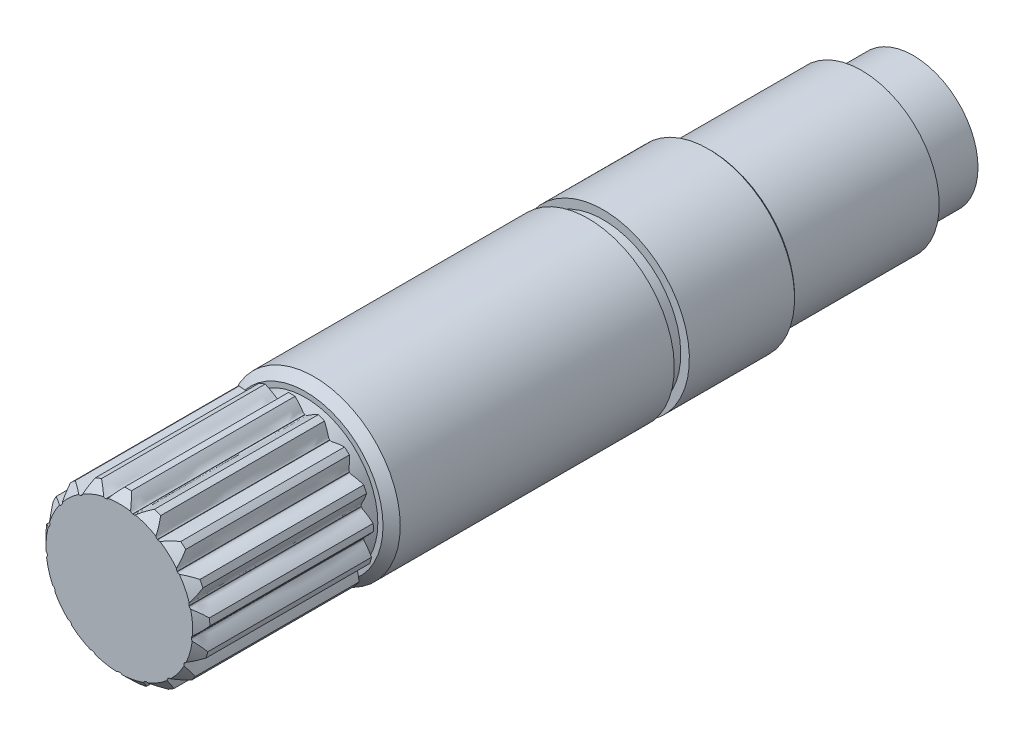
from build123d import *
from OCP.BRepFilletAPI import BRepFilletAPI_MakeChamfer

# Parameters (mm, degrees)
SKETCH12_R              = 10
SHAFT_DEPTH             = 21.5
SKETCH13_R              = 8.398146
MOTOR_SIDE_RELIEF_DEPTH = 1.587
MOTOR_SPLINE_DEPTH      = 20
CHAMFER3_SIZE           = 1
SKETCH23_W              = 1
SKETCH23_H              = 1.75
CHAMFER4_SIZE           = 1
CHAMFER4_SIZE2          = 0.466307658
CHAMFER5_SIZE           = 0.25
CHAMFER6_SIZE           = 1


with BuildPart() as part:
    # Sketch12 → Shaft (new, symmetric)
    with BuildSketch(Plane.XY):
        Circle(SKETCH12_R)
    extrude(amount=SHAFT_DEPTH, both=True)

    # Sketch13 → Motor side relief (add)
    with BuildSketch(Plane.XY.offset(21.5)):
        Circle(SKETCH13_R)
    extrude(amount=MOTOR_SIDE_RELIEF_DEPTH)

    # Sketch15 → Motor spline (add)
    with BuildSketch(Plane.XY.offset(23.087)):
        with BuildLine():
            Line((4.440221189, 7.12834427), (4.421054163, 7.140247638))
            Line((4.421054163, 7.140247638), (4.401855226, 7.152099468))
            add(Edge.make_bspline(
                [(4.401855226, 7.152099468), (4.346074893, 7.18643022), (4.303271658, 7.233316124), (4.247234181, 7.342487901), (4.237804809, 7.408052721), (4.194006084, 7.602023317), (4.124459498, 7.868486133), (3.983153486, 8.288727427), (3.862105942, 8.580360972), (3.794372065, 8.728433243)],
                knots=[0, 0, 0, 0, 0.125, 0.125, 0.25, 0.25, 0.5, 0.75, 1, 1, 1, 1], degree=3, weights=[1, 1, 1, 1, 1, 1, 1, 1, 1, 1]))
            ThreePointArc((3.794372065, 8.728433243), (3.438117558, 8.874804443), (3.076232661, 9.006641931))
            add(Edge.make_bspline(
                [(3.076232661, 9.006641931), (2.926421077, 8.942847219), (2.64049232, 8.808876568), (2.252952462, 8.593511743), (2.022042097, 8.443446649), (1.858997303, 8.329607659), (1.80785818, 8.287507199), (1.692897433, 8.244580486), (1.629678632, 8.238767738), (1.56532799, 8.250975974)],
                knots=[0, 0, 0, 0, 0.25, 0.5, 0.75, 0.75, 0.875, 0.875, 1, 1, 1, 1], degree=3, weights=[1, 1, 1, 1, 1, 1, 1, 1, 1, 1]))
            Line((1.56532799, 8.250975974), (1.543155278, 8.255151605))
            Line((1.543155278, 8.255151605), (1.520971428, 8.259267652))
            add(Edge.make_bspline(
                [(1.520971428, 8.259267652), (1.456556118, 8.271129944), (1.399706148, 8.299387436), (1.308015362, 8.380944015), (1.27553799, 8.438675107), (1.164626634, 8.603725376), (1.003518902, 8.827071428), (0.719946305, 9.167889145), (0.501722644, 9.39610191), (0.38507281, 9.509706892)],
                knots=[0, 0, 0, 0, 0.125, 0.125, 0.25, 0.25, 0.5, 0.75, 1, 1, 1, 1], degree=3, weights=[1, 1, 1, 1, 1, 1, 1, 1, 1, 1]))
            ThreePointArc((0.38507281, 9.509706892), (0, 9.5175), (-0.38507281, 9.509706892))
            add(Edge.make_bspline(
                [(-0.38507281, 9.509706892), (-0.501722644, 9.39610191), (-0.719947489, 9.167888617), (-1.003518896, 8.827071355), (-1.164626634, 8.603725376), (-1.27553799, 8.438675107), (-1.308015362, 8.380944015), (-1.399706148, 8.299387436), (-1.456556118, 8.271129944), (-1.520971428, 8.259267652)],
                knots=[0, 0, 0, 0, 0.25, 0.5, 0.75, 0.75, 0.875, 0.875, 1, 1, 1, 1], degree=3, weights=[1, 1, 1, 1, 1, 1, 1, 1, 1, 1]))
            Line((-1.520971428, 8.259267652), (-1.543155278, 8.255151605))
            Line((-1.543155278, 8.255151605), (-1.56532799, 8.250975974))
            add(Edge.make_bspline(
                [(-1.56532799, 8.250975974), (-1.629678632, 8.238767738), (-1.692897433, 8.244580486), (-1.80785818, 8.287507199), (-1.858997303, 8.329607659), (-2.022042097, 8.443446649), (-2.252952482, 8.593511814), (-2.640493614, 8.808876633), (-2.926421077, 8.942847219), (-3.076232661, 9.006641931)],
                knots=[0, 0, 0, 0, 0.125, 0.125, 0.25, 0.25, 0.5, 0.75, 1, 1, 1, 1], degree=3, weights=[1, 1, 1, 1, 1, 1, 1, 1, 1, 1]))
            ThreePointArc((-3.076232661, 9.006641931), (-3.438117558, 8.874804443), (-3.794372065, 8.728433243))
            add(Edge.make_bspline(
                [(-3.794372065, 8.728433243), (-3.862105942, 8.580360972), (-3.9831544, 8.288726508), (-4.124459466, 7.868486068), (-4.194006084, 7.602023317), (-4.237804809, 7.408052721), (-4.247234181, 7.342487901), (-4.303271658, 7.233316124), (-4.346074893, 7.18643022), (-4.401855226, 7.152099468)],
                knots=[0, 0, 0, 0, 0.25, 0.5, 0.75, 0.75, 0.875, 0.875, 1, 1, 1, 1], degree=3, weights=[1, 1, 1, 1, 1, 1, 1, 1, 1, 1]))
            Line((-4.401855226, 7.152099468), (-4.421054163, 7.140247638))
            Line((-4.421054163, 7.140247638), (-4.440221189, 7.12834427))
            add(Edge.make_bspline(
                [(-4.440221189, 7.12834427), (-4.495816252, 7.093714296), (-4.556865835, 7.076297257), (-4.679570456, 7.074796613), (-4.742464709, 7.095580541), (-4.935622837, 7.142833664), (-5.20515015, 7.199350811), (-5.644320239, 7.260176519), (-5.959335416, 7.281811458), (-6.122075865, 7.287180068)],
                knots=[0, 0, 0, 0, 0.125, 0.125, 0.25, 0.25, 0.5, 0.75, 1, 1, 1, 1], degree=3, weights=[1, 1, 1, 1, 1, 1, 1, 1, 1, 1]))
            ThreePointArc((-6.122075865, 7.287180068), (-6.411898288, 7.03351737), (-6.691220346, 6.768336319))
            add(Edge.make_bspline(
                [(-6.691220346, 6.768336319), (-6.700890432, 6.605794739), (-6.708414237, 6.290125953), (-6.688368931, 5.847218136), (-6.656961773, 5.573625885), (-6.627732607, 5.376931766), (-6.612840489, 5.312388111), (-6.625656486, 5.190345388), (-6.648632171, 5.131163273), (-6.688244085, 5.07900062)],
                knots=[0, 0, 0, 0, 0.25, 0.5, 0.75, 0.75, 0.875, 0.875, 1, 1, 1, 1], degree=3, weights=[1, 1, 1, 1, 1, 1, 1, 1, 1, 1]))
            Line((-6.688244085, 5.07900062), (-6.701865185, 5.061013661))
            Line((-6.701865185, 5.061013661), (-6.715437913, 5.042990172))
            add(Edge.make_bspline(
                [(-6.715437913, 5.042990172), (-6.754768975, 4.990615431), (-6.805404256, 4.952320872), (-6.919280812, 4.906595542), (-6.985435977, 4.903255953), (-7.182620365, 4.877541414), (-7.454363447, 4.832877588), (-7.88585014, 4.730949337), (-8.187408485, 4.637326709), (-8.3410988, 4.583544158)],
                knots=[0, 0, 0, 0, 0.125, 0.125, 0.25, 0.25, 0.5, 0.75, 1, 1, 1, 1], degree=3, weights=[1, 1, 1, 1, 1, 1, 1, 1, 1, 1]))
            ThreePointArc((-8.3410988, 4.583544158), (-8.519716625, 4.242314801), (-8.684382243, 3.89413807))
            add(Edge.make_bspline(
                [(-8.684382243, 3.89413807), (-8.634682538, 3.739079323), (-8.527665559, 3.442009035), (-8.34897711, 3.036250994), (-8.220857887, 2.792479392), (-8.12254839, 2.619626382), (-8.085346046, 2.564820869), (-8.05320969, 2.446389747), (-8.053254834, 2.382904293), (-8.071348519, 2.319954594)],
                knots=[0, 0, 0, 0, 0.25, 0.5, 0.75, 0.75, 0.875, 0.875, 1, 1, 1, 1], degree=3, weights=[1, 1, 1, 1, 1, 1, 1, 1, 1, 1]))
            Line((-8.071348519, 2.319954594), (-8.077552178, 2.298261745))
            Line((-8.077552178, 2.298261745), (-8.083697534, 2.276552308))
            add(Edge.make_bspline(
                [(-8.083697534, 2.276552308), (-8.101452719, 2.213506297), (-8.134835122, 2.159506112), (-8.224503954, 2.075731554), (-8.284985409, 2.048719478), (-8.459565212, 1.953510168), (-8.696823654, 1.813697467), (-9.062352282, 1.562781232), (-9.30972667, 1.366545292), (-9.433610123, 1.260875211)],
                knots=[0, 0, 0, 0, 0.125, 0.125, 0.25, 0.25, 0.5, 0.75, 1, 1, 1, 1], degree=3, weights=[1, 1, 1, 1, 1, 1, 1, 1, 1, 1]))
            ThreePointArc((-9.433610123, 1.260875211), (-9.476900023, 0.878164111), (-9.504670196, 0.494014896))
            add(Edge.make_bspline(
                [(-9.504670196, 0.494014896), (-9.402312921, 0.367380525), (-9.195208395, 0.129029723), (-8.882009667, -0.184778668), (-8.67448159, -0.365806916), (-8.520369004, -0.491474062), (-8.465880817, -0.529139644), (-8.393132302, -0.627964385), (-8.370240806, -0.687179116), (-8.364372611, -0.752414155)],
                knots=[0, 0, 0, 0, 0.25, 0.5, 0.75, 0.75, 0.875, 0.875, 1, 1, 1, 1], degree=3, weights=[1, 1, 1, 1, 1, 1, 1, 1, 1, 1]))
            Line((-8.364372611, -0.752414155), (-8.36232099, -0.774883154))
            Line((-8.36232099, -0.774883154), (-8.360209011, -0.79734656))
            add(Edge.make_bspline(
                [(-8.360209011, -0.79734656), (-8.353990381, -0.862549127), (-8.365611428, -0.924961915), (-8.418962263, -1.035471482), (-8.465601653, -1.082507914), (-8.593998901, -1.234353451), (-8.764729637, -1.450432547), (-9.014933532, -1.816449138), (-9.174714682, -2.088795639), (-9.252060125, -2.23208192)],
                knots=[0, 0, 0, 0, 0.125, 0.125, 0.25, 0.25, 0.5, 0.75, 1, 1, 1, 1], degree=3, weights=[1, 1, 1, 1, 1, 1, 1, 1, 1, 1]))
            ThreePointArc((-9.252060125, -2.23208192), (-9.154175559, -2.604587508), (-9.041299772, -2.972827726))
            add(Edge.make_bspline(
                [(-9.041299772, -2.972827726), (-8.900108844, -3.053935048), (-8.620887383, -3.201375768), (-8.215477602, -3.380852948), (-7.956568487, -3.474688973), (-7.767466572, -3.53619821), (-7.703051473, -3.551636916), (-7.599515889, -3.617508448), (-7.556779376, -3.664455177), (-7.527741833, -3.723165203)],
                knots=[0, 0, 0, 0, 0.25, 0.5, 0.75, 0.75, 0.875, 0.875, 1, 1, 1, 1], degree=3, weights=[1, 1, 1, 1, 1, 1, 1, 1, 1, 1]))
            Line((-7.527741833, -3.723165203), (-7.517712015, -3.74337579))
            Line((-7.517712015, -3.74337579), (-7.507627934, -3.763559357))
            add(Edge.make_bspline(
                [(-7.507627934, -3.763559357), (-7.478275351, -3.822112512), (-7.466565555, -3.88450871), (-7.476393067, -4.006828357), (-7.502891484, -4.067536614), (-7.567765417, -4.255510796), (-7.648910315, -4.518673608), (-7.749998055, -4.950357987), (-7.800606636, -5.262033145), (-7.82096814, -5.423584019)],
                knots=[0, 0, 0, 0, 0.125, 0.125, 0.25, 0.25, 0.5, 0.75, 1, 1, 1, 1], degree=3, weights=[1, 1, 1, 1, 1, 1, 1, 1, 1, 1]))
            ThreePointArc((-7.82096814, -5.423584019), (-7.595128961, -5.735575152), (-7.356851714, -6.038173492))
            add(Edge.make_bspline(
                [(-7.356851714, -6.038173492), (-7.19589575, -6.062799771), (-6.882267761, -6.099417722), (-6.439399763, -6.120324303), (-6.164076721, -6.114295031), (-5.965524738, -6.103339195), (-5.899882343, -6.094465941), (-5.779542744, -6.118487949), (-5.722733018, -6.146826261), (-5.674447808, -6.19108216)],
                knots=[0, 0, 0, 0, 0.25, 0.5, 0.75, 0.75, 0.875, 0.875, 1, 1, 1, 1], degree=3, weights=[1, 1, 1, 1, 1, 1, 1, 1, 1, 1]))
            Line((-5.674447808, -6.19108216), (-5.657794375, -6.206304782))
            Line((-5.657794375, -6.206304782), (-5.641100105, -6.221482608))
            add(Edge.make_bspline(
                [(-5.641100105, -6.221482608), (-5.592577797, -6.265478423), (-5.559118631, -6.319431079), (-5.524095559, -6.437040859), (-5.526874245, -6.503221956), (-5.51946328, -6.701937828), (-5.50006327, -6.97664276), (-5.438382397, -7.415693559), (-5.37298344, -7.724603916), (-5.333611069, -7.882601043)],
                knots=[0, 0, 0, 0, 0.125, 0.125, 0.25, 0.25, 0.5, 0.75, 1, 1, 1, 1], degree=3, weights=[1, 1, 1, 1, 1, 1, 1, 1, 1, 1]))
            ThreePointArc((-5.333611069, -7.882601043), (-5.01031811, -8.091941589), (-4.678820066, -8.288030468))
            add(Edge.make_bspline(
                [(-4.678820066, -8.288030468), (-4.519837062, -8.252849789), (-4.214159742, -8.173699515), (-3.793645304, -8.033211947), (-3.539092238, -7.928131664), (-3.357905732, -7.846190402), (-3.29990141, -7.814203571), (-3.179010326, -7.793131749), (-3.115799855, -7.799034398), (-3.054788163, -7.822859165)],
                knots=[0, 0, 0, 0, 0.25, 0.5, 0.75, 0.75, 0.875, 0.875, 1, 1, 1, 1], degree=3, weights=[1, 1, 1, 1, 1, 1, 1, 1, 1, 1]))
            Line((-3.054788163, -7.822859165), (-3.033760254, -7.831037923))
            Line((-3.033760254, -7.831037923), (-3.012710447, -7.839160159))
            add(Edge.make_bspline(
                [(-3.012710447, -7.839160159), (-2.951571621, -7.862656755), (-2.900881931, -7.900879263), (-2.825738336, -7.997895325), (-2.804422014, -8.060611137), (-2.725727042, -8.24323102), (-2.608402205, -8.492377648), (-2.392283061, -8.879498624), (-2.219709058, -9.143924126), (-2.12592027, -9.277029118)],
                knots=[0, 0, 0, 0, 0.125, 0.125, 0.25, 0.25, 0.5, 0.75, 1, 1, 1, 1], degree=3, weights=[1, 1, 1, 1, 1, 1, 1, 1, 1, 1]))
            ThreePointArc((-2.12592027, -9.277029118), (-1.748836036, -9.355446476), (-1.368887842, -9.418543004))
            add(Edge.make_bspline(
                [(-1.368887842, -9.418543004), (-1.233349333, -9.328306713), (-0.976906098, -9.144077896), (-0.635538026, -8.861169804), (-0.436133737, -8.671230184), (-0.29678295, -8.529370118), (-0.254250507, -8.478589709), (-0.149134948, -8.415269923), (-0.088060657, -8.397939724), (-0.02256245, -8.398115692)],
                knots=[0, 0, 0, 0, 0.25, 0.5, 0.75, 0.75, 0.875, 0.875, 1, 1, 1, 1], degree=3, weights=[1, 1, 1, 1, 1, 1, 1, 1, 1, 1]))
            Line((-0.02256245, -8.398115692), (0, -8.398146))
            Line((0, -8.398146), (0.02256245, -8.398115692))
            add(Edge.make_bspline(
                [(0.02256245, -8.398115692), (0.088060657, -8.397939724), (0.149134948, -8.415269923), (0.254250507, -8.478589709), (0.29678295, -8.529370118), (0.436133737, -8.671230184), (0.635538032, -8.861169877), (0.976907359, -9.144078197), (1.233349333, -9.328306713), (1.368887842, -9.418543004)],
                knots=[0, 0, 0, 0, 0.125, 0.125, 0.25, 0.25, 0.5, 0.75, 1, 1, 1, 1], degree=3, weights=[1, 1, 1, 1, 1, 1, 1, 1, 1, 1]))
            ThreePointArc((1.368887842, -9.418543004), (1.748836036, -9.355446476), (2.12592027, -9.277029118))
            add(Edge.make_bspline(
                [(2.12592027, -9.277029118), (2.219709058, -9.143924126), (2.392284128, -8.879497888), (2.608402185, -8.492377578), (2.725727042, -8.24323102), (2.804422014, -8.060611137), (2.825738336, -7.997895325), (2.900881931, -7.900879263), (2.951571621, -7.862656755), (3.012710447, -7.839160159)],
                knots=[0, 0, 0, 0, 0.25, 0.5, 0.75, 0.75, 0.875, 0.875, 1, 1, 1, 1], degree=3, weights=[1, 1, 1, 1, 1, 1, 1, 1, 1, 1]))
            Line((3.012710447, -7.839160159), (3.033760254, -7.831037923))
            Line((3.033760254, -7.831037923), (3.054788163, -7.822859165))
            add(Edge.make_bspline(
                [(3.054788163, -7.822859165), (3.115799855, -7.799034398), (3.179010326, -7.793131749), (3.29990141, -7.814203571), (3.357905732, -7.846190402), (3.539092238, -7.928131664), (3.793645337, -8.033212013), (4.214161026, -8.17369934), (4.519837062, -8.252849789), (4.678820066, -8.288030468)],
                knots=[0, 0, 0, 0, 0.125, 0.125, 0.25, 0.25, 0.5, 0.75, 1, 1, 1, 1], degree=3, weights=[1, 1, 1, 1, 1, 1, 1, 1, 1, 1]))
            ThreePointArc((4.678820066, -8.288030468), (5.01031811, -8.091941589), (5.333611069, -7.882601043))
            add(Edge.make_bspline(
                [(5.333611069, -7.882601043), (5.37298344, -7.724603916), (5.438383126, -7.415692487), (5.500063226, -6.976642702), (5.51946328, -6.701937828), (5.526874245, -6.503221956), (5.524095559, -6.437040859), (5.559118631, -6.319431079), (5.592577797, -6.265478423), (5.641100105, -6.221482608)],
                knots=[0, 0, 0, 0, 0.25, 0.5, 0.75, 0.75, 0.875, 0.875, 1, 1, 1, 1], degree=3, weights=[1, 1, 1, 1, 1, 1, 1, 1, 1, 1]))
            Line((5.641100105, -6.221482608), (5.657794375, -6.206304782))
            Line((5.657794375, -6.206304782), (5.674447808, -6.19108216))
            add(Edge.make_bspline(
                [(5.674447808, -6.19108216), (5.722733018, -6.146826261), (5.779542744, -6.118487949), (5.899882343, -6.094465941), (5.965524738, -6.103339195), (6.164076721, -6.114295031), (6.439399817, -6.120324352), (6.882268896, -6.099417095), (7.19589575, -6.062799771), (7.356851714, -6.038173492)],
                knots=[0, 0, 0, 0, 0.125, 0.125, 0.25, 0.25, 0.5, 0.75, 1, 1, 1, 1], degree=3, weights=[1, 1, 1, 1, 1, 1, 1, 1, 1, 1]))
            ThreePointArc((7.356851714, -6.038173492), (7.595128961, -5.735575152), (7.82096814, -5.423584019))
            add(Edge.make_bspline(
                [(7.82096814, -5.423584019), (7.800606636, -5.262033145), (7.749998348, -4.950356724), (7.648910253, -4.51867357), (7.567765417, -4.255510796), (7.502891484, -4.067536614), (7.476393067, -4.006828357), (7.466565555, -3.88450871), (7.478275351, -3.822112512), (7.507627934, -3.763559357)],
                knots=[0, 0, 0, 0, 0.25, 0.5, 0.75, 0.75, 0.875, 0.875, 1, 1, 1, 1], degree=3, weights=[1, 1, 1, 1, 1, 1, 1, 1, 1, 1]))
            Line((7.507627934, -3.763559357), (7.517712015, -3.74337579))
            Line((7.517712015, -3.74337579), (7.527741833, -3.723165203))
            add(Edge.make_bspline(
                [(7.527741833, -3.723165203), (7.556779376, -3.664455177), (7.599515889, -3.617508448), (7.703051473, -3.551636916), (7.767466572, -3.53619821), (7.956568487, -3.474688973), (8.21547767, -3.380852974), (8.620888215, -3.201374774), (8.900108844, -3.053935048), (9.041299772, -2.972827726)],
                knots=[0, 0, 0, 0, 0.125, 0.125, 0.25, 0.25, 0.5, 0.75, 1, 1, 1, 1], degree=3, weights=[1, 1, 1, 1, 1, 1, 1, 1, 1, 1]))
            ThreePointArc((9.041299772, -2.972827726), (9.154175559, -2.604587508), (9.252060125, -2.23208192))
            add(Edge.make_bspline(
                [(9.252060125, -2.23208192), (9.174714682, -2.088795639), (9.014933348, -1.816447855), (8.764729565, -1.450432533), (8.593998901, -1.234353451), (8.465601653, -1.082507914), (8.418962263, -1.035471482), (8.365611428, -0.924961915), (8.353990381, -0.862549127), (8.360209011, -0.79734656)],
                knots=[0, 0, 0, 0, 0.25, 0.5, 0.75, 0.75, 0.875, 0.875, 1, 1, 1, 1], degree=3, weights=[1, 1, 1, 1, 1, 1, 1, 1, 1, 1]))
            Line((8.360209011, -0.79734656), (8.36232099, -0.774883154))
            Line((8.36232099, -0.774883154), (8.364372611, -0.752414155))
            add(Edge.make_bspline(
                [(8.364372611, -0.752414155), (8.370240806, -0.687179116), (8.393132302, -0.627964385), (8.465880817, -0.529139644), (8.520369004, -0.491474062), (8.67448159, -0.365806916), (8.88200974, -0.184778668), (9.195208811, 0.12903095), (9.402312921, 0.367380525), (9.504670196, 0.494014896)],
                knots=[0, 0, 0, 0, 0.125, 0.125, 0.25, 0.25, 0.5, 0.75, 1, 1, 1, 1], degree=3, weights=[1, 1, 1, 1, 1, 1, 1, 1, 1, 1]))
            ThreePointArc((9.504670196, 0.494014896), (9.476900023, 0.878164111), (9.433610123, 1.260875211))
            add(Edge.make_bspline(
                [(9.433610123, 1.260875211), (9.30972667, 1.366545292), (9.062351647, 1.562782362), (8.696823583, 1.813697454), (8.459565212, 1.953510168), (8.284985409, 2.048719478), (8.224503954, 2.075731554), (8.134835122, 2.159506112), (8.101452719, 2.213506297), (8.083697534, 2.276552308)],
                knots=[0, 0, 0, 0, 0.25, 0.5, 0.75, 0.75, 0.875, 0.875, 1, 1, 1, 1], degree=3, weights=[1, 1, 1, 1, 1, 1, 1, 1, 1, 1]))
            Line((8.083697534, 2.276552308), (8.077552178, 2.298261745))
            Line((8.077552178, 2.298261745), (8.071348519, 2.319954594))
            add(Edge.make_bspline(
                [(8.071348519, 2.319954594), (8.053254834, 2.382904293), (8.05320969, 2.446389747), (8.085346046, 2.564820869), (8.12254839, 2.619626382), (8.220857887, 2.792479392), (8.348977178, 3.036251021), (8.527665504, 3.442010329), (8.634682538, 3.739079323), (8.684382243, 3.89413807)],
                knots=[0, 0, 0, 0, 0.125, 0.125, 0.25, 0.25, 0.5, 0.75, 1, 1, 1, 1], degree=3, weights=[1, 1, 1, 1, 1, 1, 1, 1, 1, 1]))
            ThreePointArc((8.684382243, 3.89413807), (8.519716625, 4.242314801), (8.3410988, 4.583544158))
            add(Edge.make_bspline(
                [(8.3410988, 4.583544158), (8.187408485, 4.637326709), (7.88584914, 4.730950162), (7.454363385, 4.83287755), (7.182620365, 4.877541414), (6.985435977, 4.903255953), (6.919280812, 4.906595542), (6.805404256, 4.952320872), (6.754768975, 4.990615431), (6.715437913, 5.042990172)],
                knots=[0, 0, 0, 0, 0.25, 0.5, 0.75, 0.75, 0.875, 0.875, 1, 1, 1, 1], degree=3, weights=[1, 1, 1, 1, 1, 1, 1, 1, 1, 1]))
            Line((6.715437913, 5.042990172), (6.701865185, 5.061013661))
            Line((6.701865185, 5.061013661), (6.688244085, 5.07900062))
            add(Edge.make_bspline(
                [(6.688244085, 5.07900062), (6.648632171, 5.131163273), (6.625656486, 5.190345388), (6.612840489, 5.312388111), (6.627732607, 5.376931766), (6.656961773, 5.573625885), (6.688368985, 5.847218185), (6.708413718, 6.290127141), (6.700890432, 6.605794739), (6.691220346, 6.768336319)],
                knots=[0, 0, 0, 0, 0.125, 0.125, 0.25, 0.25, 0.5, 0.75, 1, 1, 1, 1], degree=3, weights=[1, 1, 1, 1, 1, 1, 1, 1, 1, 1]))
            ThreePointArc((6.691220346, 6.768336319), (6.411898288, 7.03351737), (6.122075865, 7.287180068))
            add(Edge.make_bspline(
                [(6.122075865, 7.287180068), (5.959335416, 7.281811458), (5.644319009, 7.260176927), (5.205150106, 7.199350753), (4.935622837, 7.142833664), (4.742464709, 7.095580541), (4.679570456, 7.074796613), (4.556865835, 7.076297257), (4.495816252, 7.093714296), (4.440221189, 7.12834427)],
                knots=[0, 0, 0, 0, 0.25, 0.5, 0.75, 0.75, 0.875, 0.875, 1, 1, 1, 1], degree=3, weights=[1, 1, 1, 1, 1, 1, 1, 1, 1, 1]))
        make_face()
    extrude(amount=MOTOR_SPLINE_DEPTH)

    # Chamfer3
    chamfer3_edges = [part.edges().sort_by_distance(p)[0] for p in [
        (-10, 0, 21.5),
    ]]
    chamfer(chamfer3_edges, length=CHAMFER3_SIZE)

    # Sketch23 → snap ring (revolve, cut)
    with BuildSketch(Plane(origin=(0, 0, -31.5), x_dir=(-0.3181828922838932, -0.9480293492597455, 0), z_dir=(-0.9480293492597455, 0.3181828922838932, 0)), mode=Mode.PRIVATE) as snap_ring_sk:
        with Locations((9.5, 19.32924121)):
            Rectangle(SKETCH23_W, SKETCH23_H)
    revolve(snap_ring_sk.sketch.rotate(Axis((0, 0, 153.83579317), (0, 0, -1)), 341.44693055), axis=Axis((0, 0, 153.83579317), (0, 0, -1)), mode=Mode.SUBTRACT)

    # Sketch24 → Revolve1 (revolve)
    with BuildSketch(Plane(origin=(0, 0, 0), x_dir=(1, 0, 0), z_dir=(0, 1, 0)), mode=Mode.PRIVATE) as revolve1_sk:
        Polygon((10, 21.5), (10, 25.5), (9, 25.5), (9, 43.5), (7.5, 43.5), (7.5, 49.5), (0, 49.5), (0, 21.5), align=None)
    revolve(revolve1_sk.sketch.rotate(Axis((0, 0, 0), (0, 0, -1)), 90), axis=Axis((0, 0, 0), (0, 0, -1)))

    # Chamfer4: one chamfer whose edges measure the first distance from different faces: ONE call of the kernel's chamfer builder (chamfer() names one face for all edges)
    chamfer4_edges_1 = [part.edges().sort_by_distance(p)[0] for p in [
        (0, 9, -43.5),
    ]]
    chamfer4_side_1 = [part.faces().sort_by_distance(p)[0] for p in [
        (0, 8.745441559, -43.5),
    ]]
    chamfer4_edges_2 = [part.edges().sort_by_distance(p)[0] for p in [
        (0, 7.5, -49.5),
    ]]
    chamfer4_side_2 = [part.faces().sort_by_distance(p)[0] for p in [
        (0, 0, -49.5),
    ]]
    chamfer4 = BRepFilletAPI_MakeChamfer(part.part.solid().wrapped)
    for e in chamfer4_edges_1:
        chamfer4.Add(CHAMFER4_SIZE, CHAMFER4_SIZE2, e.wrapped, chamfer4_side_1[0].wrapped)  # the first distance lies on this face
    for e in chamfer4_edges_2:
        chamfer4.Add(CHAMFER4_SIZE, CHAMFER4_SIZE2, e.wrapped, chamfer4_side_2[0].wrapped)  # the first distance lies on this face
    add(Compound.cast(chamfer4.Shape()), mode=Mode.REPLACE)

    # Chamfer5
    chamfer5_edges = [part.edges().sort_by_distance(p)[0] for p in [
        (0, 10, -25.5),
    ]]
    chamfer(chamfer5_edges, length=CHAMFER5_SIZE)

    # Chamfer6
    chamfer6_edges = [part.edges().sort_by_distance(p)[0] for p in [
        (-7.595128961, -5.735575152, 43.087),
        (-5.01031811, -8.091941589, 43.087),
        (-1.748836036, -9.355446476, 43.087),
        (1.748836036, -9.355446476, 43.087),
        (5.01031811, -8.091941589, 43.087),
        (7.595128961, -5.735575152, 43.087),
        (9.154175559, -2.604587508, 43.087),
        (9.476900023, 0.878164111, 43.087),
        (8.519716625, 4.242314801, 43.087),
        (6.411898288, 7.03351737, 43.087),
        (3.438117558, 8.874804443, 43.087),
        (0, 9.5175, 43.087),
        (-3.438117558, 8.874804443, 43.087),
        (-9.154175559, -2.604587508, 43.087),
        (-9.476900023, 0.878164111, 43.087),
        (-8.519716625, 4.242314801, 43.087),
        (-6.411898288, 7.03351737, 43.087),
    ]]
    chamfer(chamfer6_edges, length=CHAMFER6_SIZE)


solid = part.part
